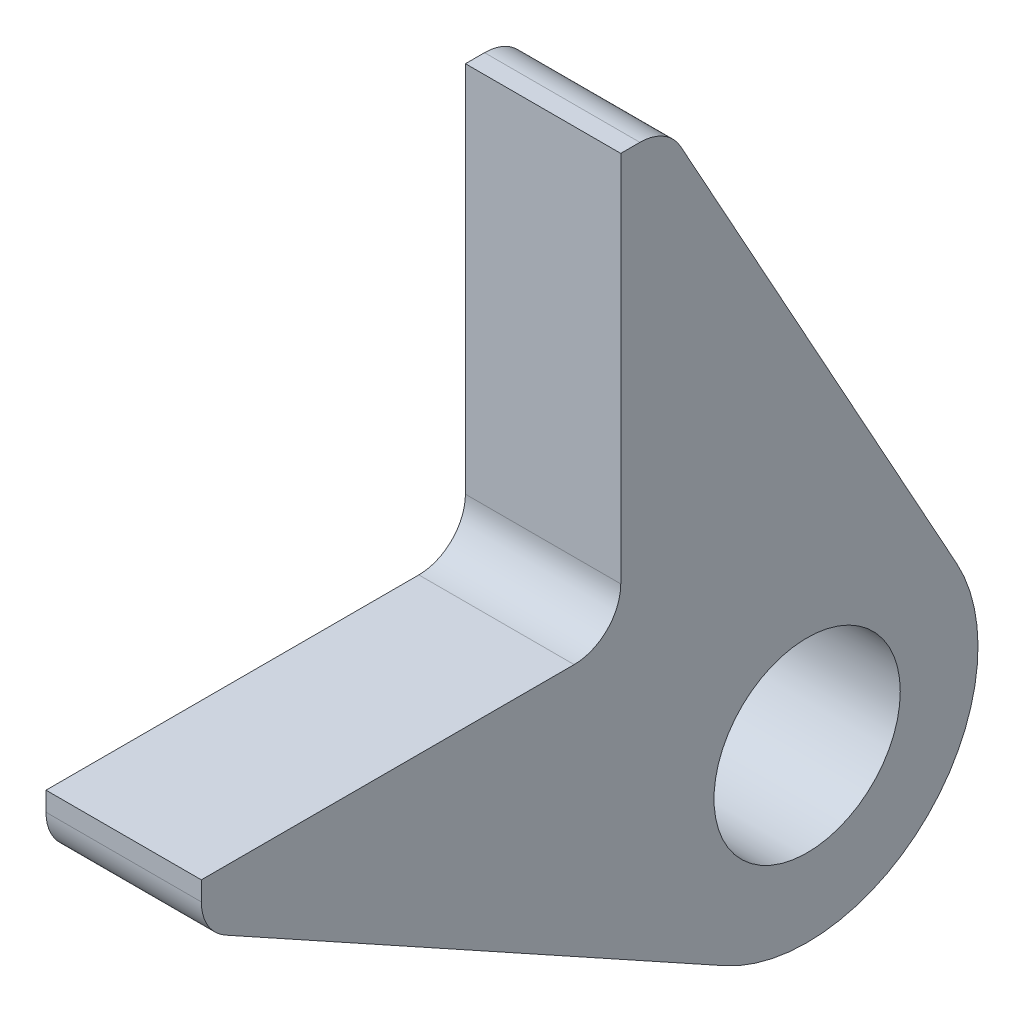
from build123d import *

# Parameters (mm, degrees)
SKETCH1_R          = 19.0373
BASE_EXTRUDE_DEPTH = 15.875


with BuildPart() as part:
    # Sketch1 → Base-Extrude (new, symmetric)
    with BuildSketch(Plane(origin=(0, 0, 0), x_dir=(0, 0, -1), z_dir=(1, 0, 0))):
        with BuildLine():
            Line((-38.090421481, 123.815421481), (-38.090421481, 47.615421481))
            ThreePointArc((-38.090421481, 47.615421481), (-40.880229391, 40.880229391), (-47.615421481, 38.090421481))
            Line((-47.615421481, 38.090421481), (-123.815421481, 38.090421481))
            Line((-123.815421481, 38.090421481), (-123.815421481, 34.182275097))
            ThreePointArc((-123.815421481, 34.182275097), (-122.495102851, 29.344007988), (-118.900181875, 25.847064595))
            Line((-118.900181875, 25.847064595), (-16.902454778, -30.562438507))
            ThreePointArc((-16.902454778, -30.562438507), (24.695704333, -24.695704333), (30.562438507, 16.902454778))
            Line((30.562438507, 16.902454778), (-25.847064595, 118.900181875))
            ThreePointArc((-25.847064595, 118.900181875), (-29.344007988, 122.495102851), (-34.182275097, 123.815421481))
            Line((-34.182275097, 123.815421481), (-38.090421481, 123.815421481))
        make_face()
        Circle(SKETCH1_R, mode=Mode.SUBTRACT)
    extrude(amount=BASE_EXTRUDE_DEPTH, both=True)


solid = part.part
